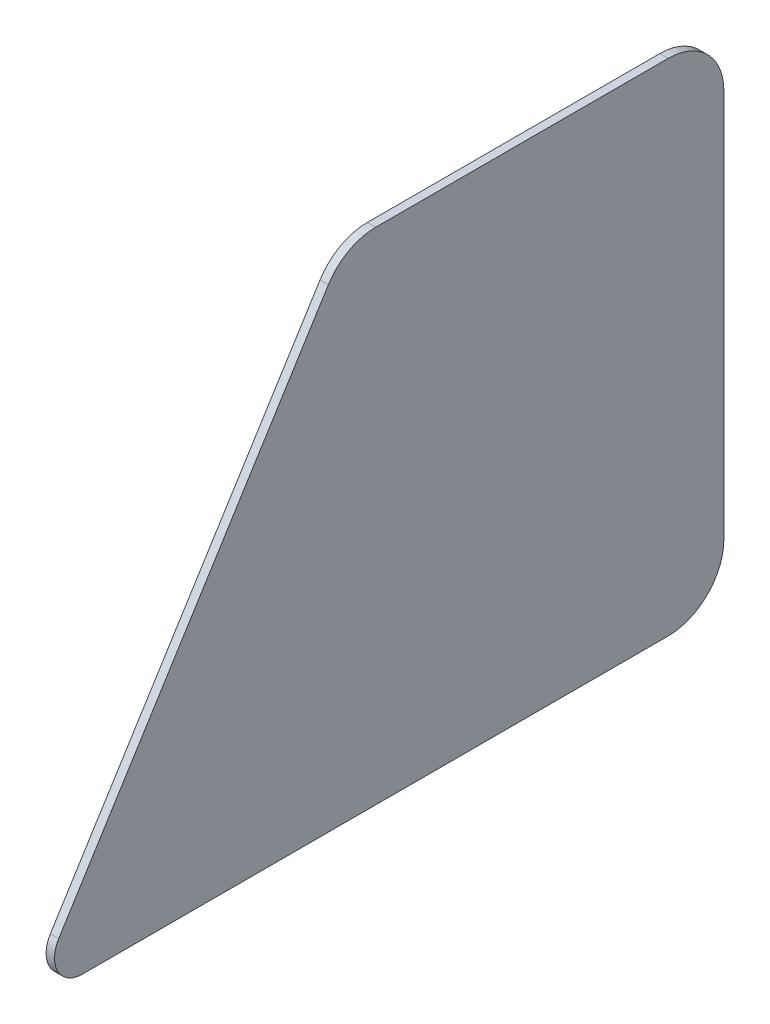
from build123d import *

# Parameters (mm, degrees)
BOSS_EXTRUDE1_DEPTH = 3


with BuildPart() as part:
    # Sketch1 → Boss-Extrude1 (new body)
    with BuildSketch(Plane(origin=(0, 0, 0), x_dir=(0, 0, -1), z_dir=(1, 0, 0))):
        with BuildLine():
            Line((-105.101332547, 0), (105.101332547, 0))
            ThreePointArc((105.101332547, 0), (119.243468171, 5.857864376), (125.101332547, 20))
            Line((125.101332547, 20), (125.101332547, 159.5))
            ThreePointArc((125.101332547, 159.5), (119.243468171, 173.642135624), (105.101332547, 179.5))
            Line((105.101332547, 179.5), (0.128643868, 179.5))
            ThreePointArc((0.128643868, 179.5), (-9.56672678, 176.992849625), (-16.831322212, 170.0999788))
            Line((-16.831322212, 170.0999788), (-113.581315587, 15.2999894))
            ThreePointArc((-113.581315587, 15.2999894), (-113.84775736, 5.152314676), (-105.101332547, 0))
        make_face()
    extrude(amount=BOSS_EXTRUDE1_DEPTH)


solid = part.part
